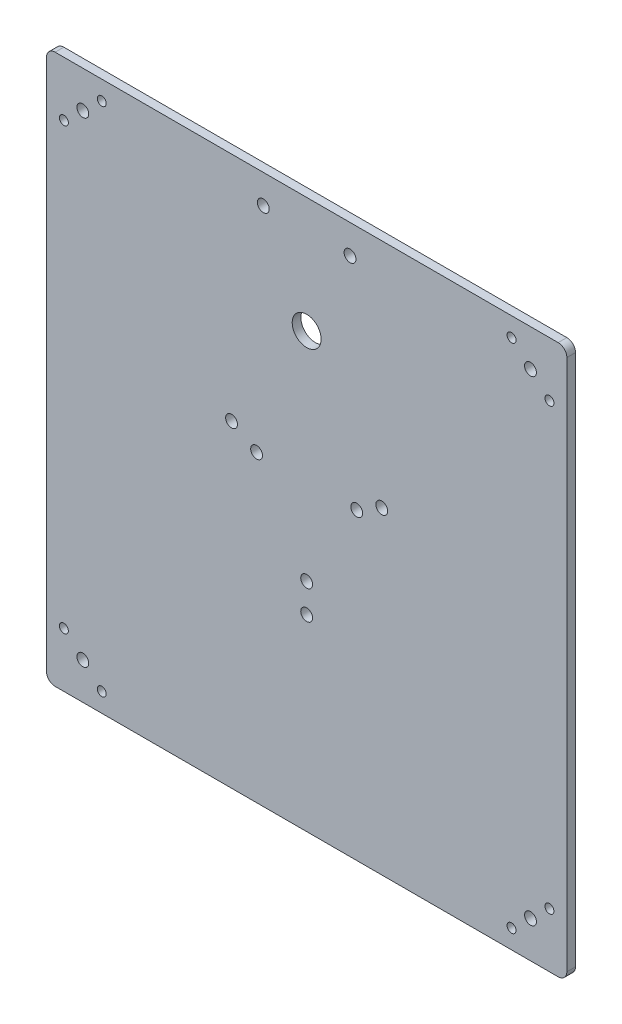
from build123d import *

# Parameters (mm, degrees)
SKETCH1_W           = 180
SKETCH1_H           = 190
BOSS_EXTRUDE1_DEPTH = 3
FILLET1_R           = 3
SKETCH2_R           = 2.05
SKETCH2_R_2         = 1.55
CUT_EXTRUDE1_DEPTH  = 3
CUT_EXTRUDE_1_REACH = 132.897
SKETCH_2_R          = 2.05
CUT_EXTRUDE_2_REACH = 132.897
SKETCH_3_R          = 2.05
CUT_EXTRUDE_3_REACH = 132.897
SKETCH_4_R          = 5


with BuildPart() as part:
    # Sketch1 → Boss-Extrude1 (new body)
    with BuildSketch(Plane.XY):
        Rectangle(SKETCH1_W, SKETCH1_H)
    extrude(amount=BOSS_EXTRUDE1_DEPTH)

    # Fillet1
    fillet1_edges = [part.edges().sort_by_distance(p)[0] for p in [
        (90, -95, 1.5),
        (-90, -95, 1.5),
        (-90, 95, 1.5),
        (90, 95, 1.5),
    ]]
    fillet(fillet1_edges, radius=FILLET1_R)

    # Sketch2 → Cut-Extrude1 (cut)
    with BuildSketch(Plane(origin=(0, 0, 0), x_dir=(-1, 0, 0), z_dir=(0, 0, -1))):
        with Locations((-77.42949016, 82.268833295)):
            Circle(SKETCH2_R)
        with Locations((77.42949016, 82.268833295)):
            Circle(SKETCH2_R)
        with Locations((-77.42949016, -82.268833295)):
            Circle(SKETCH2_R)
        with Locations((77.42949016, -82.268833295)):
            Circle(SKETCH2_R)
        with Locations((-70.875690226, 88.437115586)):
            Circle(SKETCH2_R_2)
        with Locations((-83.983290094, 76.100551004)):
            Circle(SKETCH2_R_2)
        with Locations((70.875690226, 88.437115586)):
            Circle(SKETCH2_R_2)
        with Locations((83.983290094, 76.100551004)):
            Circle(SKETCH2_R_2)
        with Locations((-83.983290094, -76.100551004)):
            Circle(SKETCH2_R_2)
        with Locations((-70.875690226, -88.437115586)):
            Circle(SKETCH2_R_2)
        with Locations((83.983290094, -76.100551004)):
            Circle(SKETCH2_R_2)
        with Locations((70.875690226, -88.437115586)):
            Circle(SKETCH2_R_2)
    extrude(amount=-CUT_EXTRUDE1_DEPTH, mode=Mode.SUBTRACT)

    # 草图2 → 切除-拉伸1 (cut, up to next)
    with BuildSketch(Plane.XY.offset(3), mode=Mode.PRIVATE) as cut_extrude_1_sk1:
        with Locations((0, -20)):
            Circle(SKETCH_2_R)
    cut_extrude_1_tool1 = extrude(cut_extrude_1_sk1.sketch, amount=-CUT_EXTRUDE_1_REACH, mode=Mode.PRIVATE) & part.part
    # 草图2 → 切除-拉伸1 (cut, up to next)
    with BuildSketch(Plane.XY.offset(3), mode=Mode.PRIVATE) as cut_extrude_1_sk2:
        with Locations((0, -30)):
            Circle(SKETCH_2_R)
    cut_extrude_1_tool2 = extrude(cut_extrude_1_sk2.sketch, amount=-CUT_EXTRUDE_1_REACH, mode=Mode.PRIVATE) & part.part
    # 草图2 → 切除-拉伸1 (cut, up to next)
    with BuildSketch(Plane.XY.offset(3), mode=Mode.PRIVATE) as cut_extrude_1_sk3:
        with Locations((-17.320508076, 10)):
            Circle(SKETCH_2_R)
    cut_extrude_1_tool3 = extrude(cut_extrude_1_sk3.sketch, amount=-CUT_EXTRUDE_1_REACH, mode=Mode.PRIVATE) & part.part
    # 草图2 → 切除-拉伸1 (cut, up to next)
    with BuildSketch(Plane.XY.offset(3), mode=Mode.PRIVATE) as cut_extrude_1_sk4:
        with Locations((-25.980762114, 15)):
            Circle(SKETCH_2_R)
    cut_extrude_1_tool4 = extrude(cut_extrude_1_sk4.sketch, amount=-CUT_EXTRUDE_1_REACH, mode=Mode.PRIVATE) & part.part
    # 草图2 → 切除-拉伸1 (cut, up to next)
    with BuildSketch(Plane.XY.offset(3), mode=Mode.PRIVATE) as cut_extrude_1_sk5:
        with Locations((17.320508076, 10)):
            Circle(SKETCH_2_R)
    cut_extrude_1_tool5 = extrude(cut_extrude_1_sk5.sketch, amount=-CUT_EXTRUDE_1_REACH, mode=Mode.PRIVATE) & part.part
    # 草图2 → 切除-拉伸1 (cut, up to next)
    with BuildSketch(Plane.XY.offset(3), mode=Mode.PRIVATE) as cut_extrude_1_sk6:
        with Locations((25.980762114, 15)):
            Circle(SKETCH_2_R)
    cut_extrude_1_tool6 = extrude(cut_extrude_1_sk6.sketch, amount=-CUT_EXTRUDE_1_REACH, mode=Mode.PRIVATE) & part.part
    add(cut_extrude_1_tool1.solids().sort_by_distance((0, -20, 3))[0], mode=Mode.SUBTRACT)
    add(cut_extrude_1_tool2.solids().sort_by_distance((0, -30, 3))[0], mode=Mode.SUBTRACT)
    add(cut_extrude_1_tool3.solids().sort_by_distance((-17.320508, 10, 3))[0], mode=Mode.SUBTRACT)
    add(cut_extrude_1_tool4.solids().sort_by_distance((-25.980762, 15, 3))[0], mode=Mode.SUBTRACT)
    add(cut_extrude_1_tool5.solids().sort_by_distance((17.320508, 10, 3))[0], mode=Mode.SUBTRACT)
    add(cut_extrude_1_tool6.solids().sort_by_distance((25.980762, 15, 3))[0], mode=Mode.SUBTRACT)

    # 草图3 → 切除-拉伸2 (cut, up to next)
    with BuildSketch(Plane(origin=(0, 0, 0), x_dir=(-1, 0, 0), z_dir=(0, 0, -1)), mode=Mode.PRIVATE) as cut_extrude_2_sk1:
        with Locations((-15, 85)):
            Circle(SKETCH_3_R)
    cut_extrude_2_tool1 = extrude(cut_extrude_2_sk1.sketch, amount=-CUT_EXTRUDE_2_REACH, mode=Mode.PRIVATE) & part.part
    # 草图3 → 切除-拉伸2 (cut, up to next)
    with BuildSketch(Plane(origin=(0, 0, 0), x_dir=(-1, 0, 0), z_dir=(0, 0, -1)), mode=Mode.PRIVATE) as cut_extrude_2_sk2:
        with Locations((15, 85)):
            Circle(SKETCH_3_R)
    cut_extrude_2_tool2 = extrude(cut_extrude_2_sk2.sketch, amount=-CUT_EXTRUDE_2_REACH, mode=Mode.PRIVATE) & part.part
    add(cut_extrude_2_tool1.solids().sort_by_distance((15, 85, 0))[0], mode=Mode.SUBTRACT)
    add(cut_extrude_2_tool2.solids().sort_by_distance((-15, 85, 0))[0], mode=Mode.SUBTRACT)

    # 草图4 → 切除-拉伸3 (cut, up to next)
    with BuildSketch(Plane.XY.offset(3), mode=Mode.PRIVATE) as cut_extrude_3_sk1:
        with Locations((0, 55)):
            Circle(SKETCH_4_R)
    cut_extrude_3_tool1 = extrude(cut_extrude_3_sk1.sketch, amount=-CUT_EXTRUDE_3_REACH, mode=Mode.PRIVATE) & part.part
    add(cut_extrude_3_tool1.solids().sort_by_distance((0, 55, 3))[0], mode=Mode.SUBTRACT)


solid = part.part
